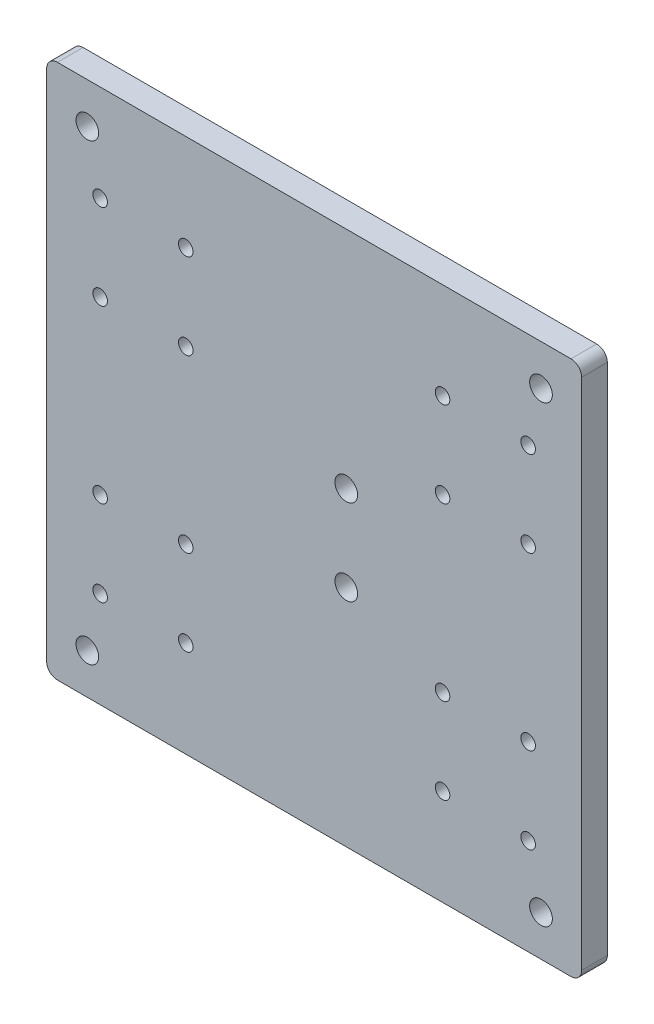
from build123d import *

# Parameters (mm, degrees)
SKETCH1_W           = 125
SKETCH1_H           = 125
SKETCH1_R           = 1.7
SKETCH1_R_2         = 2.65
BOSS_EXTRUDE1_DEPTH = 6
FILLET1_R           = 2.5


with BuildPart() as part:
    # Sketch1 → Boss-Extrude1 (new body)
    with BuildSketch(Plane.XY):
        Rectangle(SKETCH1_W, SKETCH1_H)
        with Locations((-50, 40)):
            Circle(SKETCH1_R, mode=Mode.SUBTRACT)
        with Locations((-30, 40)):
            Circle(SKETCH1_R, mode=Mode.SUBTRACT)
        with Locations((-30, 20)):
            Circle(SKETCH1_R, mode=Mode.SUBTRACT)
        with Locations((-50, 20)):
            Circle(SKETCH1_R, mode=Mode.SUBTRACT)
        with Locations((50, 40)):
            Circle(SKETCH1_R, mode=Mode.SUBTRACT)
        with Locations((50, 20)):
            Circle(SKETCH1_R, mode=Mode.SUBTRACT)
        with Locations((30, 20)):
            Circle(SKETCH1_R, mode=Mode.SUBTRACT)
        with Locations((30, 40)):
            Circle(SKETCH1_R, mode=Mode.SUBTRACT)
        with Locations((-50, -20)):
            Circle(SKETCH1_R, mode=Mode.SUBTRACT)
        with Locations((-30, -20)):
            Circle(SKETCH1_R, mode=Mode.SUBTRACT)
        with Locations((-30, -40)):
            Circle(SKETCH1_R, mode=Mode.SUBTRACT)
        with Locations((-50, -40)):
            Circle(SKETCH1_R, mode=Mode.SUBTRACT)
        with Locations((30, -40)):
            Circle(SKETCH1_R, mode=Mode.SUBTRACT)
        with Locations((30, -20)):
            Circle(SKETCH1_R, mode=Mode.SUBTRACT)
        with Locations((50, -20)):
            Circle(SKETCH1_R, mode=Mode.SUBTRACT)
        with Locations((50, -40)):
            Circle(SKETCH1_R, mode=Mode.SUBTRACT)
        with Locations((7.5, 10)):
            Circle(SKETCH1_R_2, mode=Mode.SUBTRACT)
        with Locations((7.5, -10)):
            Circle(SKETCH1_R_2, mode=Mode.SUBTRACT)
        with Locations((-53, -53)):
            Circle(SKETCH1_R_2, mode=Mode.SUBTRACT)
        with Locations((53, -53)):
            Circle(SKETCH1_R_2, mode=Mode.SUBTRACT)
        with Locations((53, 53)):
            Circle(SKETCH1_R_2, mode=Mode.SUBTRACT)
        with Locations((-53, 53)):
            Circle(SKETCH1_R_2, mode=Mode.SUBTRACT)
    extrude(amount=BOSS_EXTRUDE1_DEPTH)

    # Fillet1
    fillet1_edges = [part.edges().sort_by_distance(p)[0] for p in [
        (-62.5, -62.5, 3),
        (62.5, -62.5, 3),
        (62.5, 62.5, 3),
        (-62.5, 62.5, 3),
    ]]
    fillet(fillet1_edges, radius=FILLET1_R)


solid = part.part
